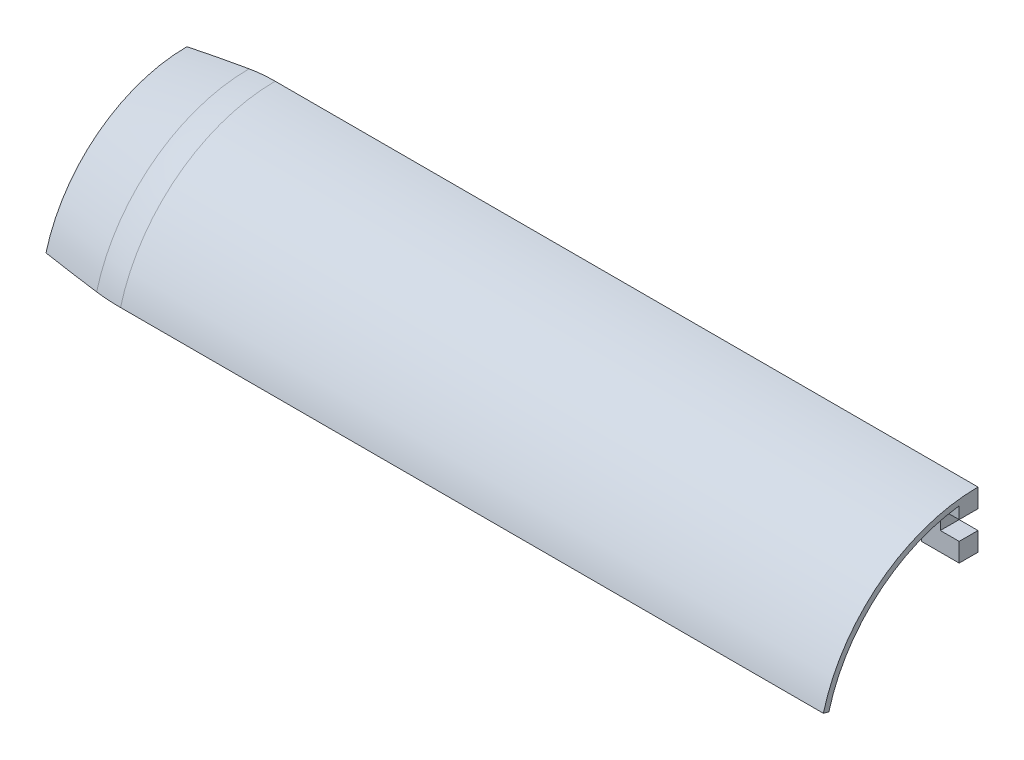
from build123d import *

# Parameters (mm, degrees)
REVOLVE1_ANGLE      = 75
FILLET1_R           = 80
FILLET2_R           = 80
SKETCH3_W           = 220
SKETCH3_H           = 208.906104004
CUT_EXTRUDE3_DEPTH  = 159
BOSS_EXTRUDE1_START = -20
BOSS_EXTRUDE1_DEPTH = 20
SKETCH6_W           = 10
SKETCH6_H           = 10
CUT_EXTRUDE4_DEPTH  = 10


with BuildPart() as part:
    # Sketch1 → Revolve1 (revolve)
    with BuildSketch(Plane.XY):
        with BuildLine():
            Line((0, 0), (3.000014971, 0))
            Line((3.000014971, 0), (2.999985029, 0.009477573))
            add(Edge.make_bspline(
                [(2.999985029, 0.009477573), (2.993785153, 1.971956174), (2.98195041, 5.919056141), (3.145368661, 11.706950418), (3.673805689, 17.348455242), (4.826995442, 22.758009885), (6.767385374, 27.848912294), (10.462264152, 34.106073266), (16.932254921, 40.80886219), (26.377617743, 47.258644811), (36.67301066, 52.572311975), (47.441384771, 57.081049673), (62.17748954, 62.31037411), (81.042213455, 67.757539775), (104.018152235, 73.218909741), (126.982089983, 77.893970447), (142.347775171, 80.65244689), (149.958103424, 81.949720096), (150, 81.956859546)],
                knots=[0, 0, 0, 0, 0.03125, 0.0625, 0.09375, 0.125, 0.15625, 0.1875, 0.25, 0.3125, 0.375, 0.4375, 0.5, 0.625, 0.75, 0.875, 0.996633751, 0.997307001, 0.997307001, 0.997307001, 0.997307001], degree=3))
            Line((150, 81.956859546), (530, 81.956859546))
            Line((530, 81.956859546), (530, 85))
            Line((530, 85), (150, 85))
            add(Edge.make_bspline(
                [(0, 0), (-0.012294225, 3.891554312), (-0.027437579, 8.684958126), (0.361573767, 14.085722357), (0.576098453, 16.090496183), (0.782493435, 17.604822189), (0.986227589, 18.854298664), (1.188670863, 19.931536976), (1.390404268, 20.885679324), (1.591698837, 21.746529091), (1.792703864, 22.533746067), (1.993507167, 23.261083862), (2.253808552, 24.139979457), (2.580573656, 25.146175179), (2.983585386, 26.259501153), (3.385879093, 27.271261727), (3.787683439, 28.201566994), (4.189138614, 29.064817448), (4.590335615, 29.871726974), (5.05331092, 30.74778076), (5.583218589, 31.683457084), (6.185429632, 32.669732492), (6.787226927, 33.590624245), (7.451481511, 34.546094958), (8.182770444, 35.530963646), (8.985083876, 36.540013411), (9.850344603, 37.562485558), (10.782608842, 38.595746542), (11.785011743, 39.636928062), (12.851029789, 40.680352273), (13.983960321, 41.72463117), (15.186170623, 42.768194245), (16.387975322, 43.755294725), (17.654380903, 44.743506811), (18.987602276, 45.731471932), (20.389198856, 46.717890971), (21.790522044, 47.657861765), (23.257103599, 48.59836715), (24.790441056, 49.538186318), (26.391587757, 50.476245251), (28.05829275, 51.412163763), (29.791720393, 52.345056651), (31.59268286, 53.274185034), (33.459445798, 54.199628429), (35.392909821, 55.120726442), (37.459746918, 56.067201212), (39.59327023, 57.006562681), (41.860151348, 57.96659169), (44.193707143, 58.917521836), (46.660609333, 59.885320784), (49.260404933, 60.867669295), (51.99403381, 61.861671206), (54.860992187, 62.865616104), (57.794602823, 63.85555089), (60.861539281, 64.853573463), (64.06149587, 65.858380358), (67.461497598, 66.888166734), (70.995135905, 67.920234745), (74.662088876, 68.953918346), (78.462130407, 69.988575944), (82.462197069, 71.040436012), (86.662284614, 72.107100186), (91.062388571, 73.18640193), (95.662505252, 74.276388609), (100.462631288, 75.375305679), (105.462763855, 76.481579791), (110.662900527, 77.593803027), (116.063039296, 78.710717608), (121.663178505, 79.831201671), (127.529872228, 80.967142806), (133.663251007, 82.116215238), (140.063409966, 83.276352633), (145.198462089, 84.177415336), (148.333178957, 84.715838785), (149.39998937, 84.897876633), (149.733326587, 84.954653305), (149.933332963, 84.98866355), (150, 85)],
                knots=[0, 0, 0, 0, 0.061462209, 0.075705788, 0.085548437, 0.093321935, 0.099856333, 0.105553797, 0.110642995, 0.115267654, 0.119524592, 0.123482434, 0.127191759, 0.134010181, 0.140199136, 0.145901384, 0.151215493, 0.156212588, 0.160945789, 0.165455878, 0.171870938, 0.177937368, 0.183716425, 0.189254732, 0.196326298, 0.203099892, 0.209625632, 0.217492532, 0.225090541, 0.232464167, 0.24106462, 0.249438142, 0.257620809, 0.265641058, 0.274822876, 0.28384341, 0.292725747, 0.301488561, 0.311376345, 0.321146599, 0.330814589, 0.341584449, 0.352255608, 0.362840299, 0.374512001, 0.386101174, 0.398765505, 0.411352526, 0.425006218, 0.438588433, 0.453231339, 0.468927603, 0.484557057, 0.501237456, 0.517857889, 0.535527769, 0.554243231, 0.574001115, 0.593705628, 0.614453399, 0.636242373, 0.65907093, 0.682937829, 0.707842151, 0.733783254, 0.760760729, 0.78877436, 0.81782409, 0.847909993, 0.879032247, 0.912262482, 0.946527454, 0.981827786, 0.994656092, 0.99679374, 0.998931275, 1, 1, 1, 1], degree=3))
        make_face()
    revolve(axis=Axis((0, 0, 0), (1, 0, 0)), revolution_arc=REVOLVE1_ANGLE)

    # Fillet1
    fillet1_edges = [part.edges().sort_by_distance(p)[0] for p in [
        (150, 65.020748281, 49.892174934),
    ]]
    fillet(fillet1_edges, radius=FILLET1_R)

    # Fillet2
    fillet2_edges = [part.edges().sort_by_distance(p)[0] for p in [
        (150, 67.435033925, 51.744721466),
    ]]
    fillet(fillet2_edges, radius=FILLET2_R)

    # Sketch3 → Cut-Extrude3 (cut)
    with BuildSketch(Plane(origin=(0, 0, 0), x_dir=(1, 0, 0), z_dir=(0, 1, 0))):
        Rectangle(SKETCH3_W, SKETCH3_H)
    extrude(amount=CUT_EXTRUDE3_DEPTH, mode=Mode.SUBTRACT)

    # Sketch5 → Boss-Extrude1 (add)
    with BuildSketch(Plane(origin=(530, 0, 0), x_dir=(0, 0, -1), z_dir=(1, 0, 0)).offset(BOSS_EXTRUDE1_START)):
        with BuildLine():
            Line((0, 85), (0, 55))
            Line((0, 55), (-10, 55))
            Line((-10, 55), (-10, 84.409715081))
            ThreePointArc((-10, 84.409715081), (-5.008703332, 84.852300446), (0, 85))
        make_face()
    extrude(amount=BOSS_EXTRUDE1_DEPTH)

    # Sketch6 → Cut-Extrude4 (cut)
    with BuildSketch(Plane(origin=(530, 0, 0), x_dir=(0, 0, -1), z_dir=(1, 0, 0))):
        with Locations((-5, 70)):
            Rectangle(SKETCH6_W, SKETCH6_H)
    extrude(amount=-CUT_EXTRUDE4_DEPTH, mode=Mode.SUBTRACT)


solid = part.part
